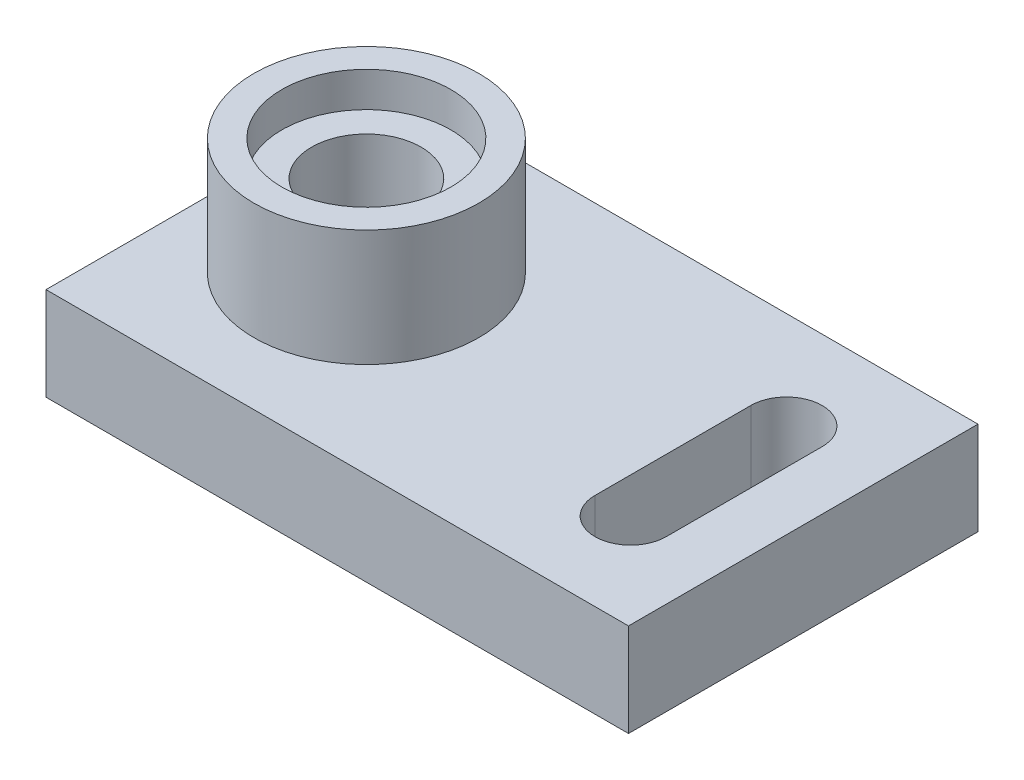
from build123d import *

# Parameters (mm, degrees)
SKETCH1_W           = 127
SKETCH1_H           = 76.2
BOSS_EXTRUDE1_DEPTH = 20.32
CUT_EXTRUDE2_DEPTH  = 150.493619931
SKETCH4_R           = 24.515114189
BOSS_EXTRUDE2_DEPTH = 25.4
SKETCH5_R           = 11.931407315
CUT_EXTRUDE3_DEPTH  = 156.002446432
SKETCH6_R           = 18.430592643
CUT_EXTRUDE4_DEPTH  = 7.62


with BuildPart() as part:
    # Sketch1 → Boss-Extrude1 (new body)
    with BuildSketch(Plane(origin=(0, 0, 0), x_dir=(1, 0, 0), z_dir=(0, 1, 0))):
        with Locations((63.5, 38.1)):
            Rectangle(SKETCH1_W, SKETCH1_H)
    extrude(amount=BOSS_EXTRUDE1_DEPTH)

    # Sketch2 → Cut-Extrude2 (cut, through all)
    with BuildSketch(Plane(origin=(0, 20.32, 0), x_dir=(1, 0, 0), z_dir=(0, 1, 0))):
        with BuildLine():
            Line((98.708096341, 20.973581043), (98.708096341, 54.953487977))
            ThreePointArc((98.708096341, 54.953487977), (106.486629254, 62.73202089), (114.265162167, 54.953487977))
            Line((114.265162167, 54.953487977), (114.265162167, 20.973581043))
            ThreePointArc((114.265162167, 20.973581043), (106.486629254, 13.195048131), (98.708096341, 20.973581043))
        make_face()
    extrude(amount=-CUT_EXTRUDE2_DEPTH, mode=Mode.SUBTRACT)

    # Sketch4 → Boss-Extrude2 (add)
    with BuildSketch(Plane(origin=(0, 20.32, 0), x_dir=(1, 0, 0), z_dir=(0, 1, 0))):
        with Locations(Location((31.75, 38.1, 0), (0, 0, 90))):
            Circle(SKETCH4_R)
    extrude(amount=BOSS_EXTRUDE2_DEPTH)

    # Sketch5 → Cut-Extrude3 (cut, through all)
    with BuildSketch(Plane(origin=(0, 45.72, 0), x_dir=(1, 0, 0), z_dir=(0, 1, 0))):
        with Locations(Location((31.75, 38.1, 0), (0, 0, 270))):
            Circle(SKETCH5_R)
    extrude(amount=-CUT_EXTRUDE3_DEPTH, mode=Mode.SUBTRACT)

    # Sketch6 → Cut-Extrude4 (cut)
    with BuildSketch(Plane(origin=(0, 45.72, 0), x_dir=(1, 0, 0), z_dir=(0, 1, 0))):
        with Locations(Location((31.75, 38.1, 0), (0, 0, 270))):
            Circle(SKETCH6_R)
    extrude(amount=-CUT_EXTRUDE4_DEPTH, mode=Mode.SUBTRACT)


solid = part.part
